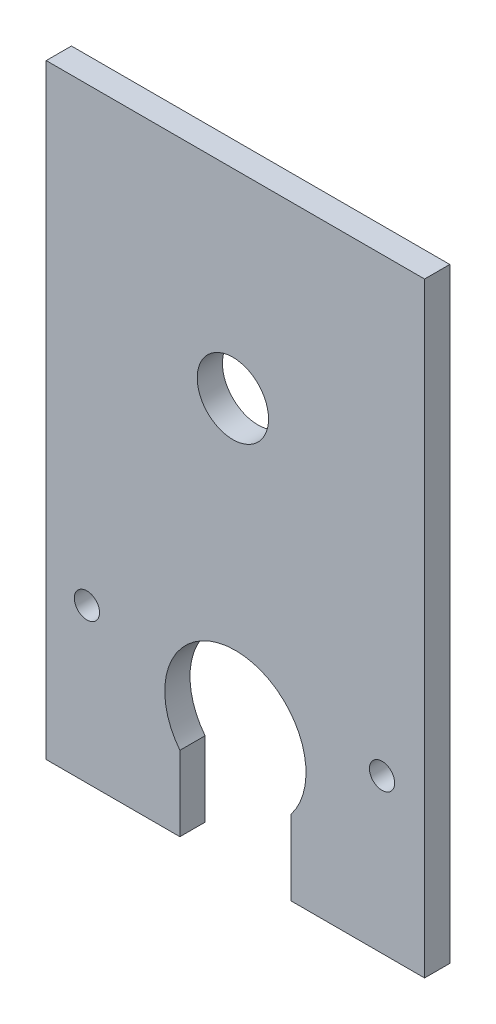
from build123d import *

# Parameters (mm, degrees)
ESQUISSE1_W             = 150
ESQUISSE1_H             = 240
BASE_EXTRUSION_DEPTH    = 10
ENL_V_MAT_EXTRU_1_DEPTH = 10
ESQUISSE3_R             = 14.142135624
ENL_V_MAT_EXTRU_2_DEPTH = 10
ESQUISSE4_R             = 5
ENL_V_MAT_EXTRU_3_DEPTH = 284.19604517


with BuildPart() as part:
    # Esquisse1 → Base-Extrusion (new body)
    with BuildSketch(Plane.XY):
        with Locations((75, 120)):
            Rectangle(ESQUISSE1_W, ESQUISSE1_H)
    extrude(amount=BASE_EXTRUSION_DEPTH)

    # Esquisse2 → Enlèv. mat.-Extru.1 (cut)
    with BuildSketch(Plane.XY.offset(10)):
        with BuildLine():
            Line((53, 0), (97, 0))
            Line((97, 0), (97, 29.679491924))
            ThreePointArc((97, 29.679491924), (75, 75), (53, 29.679491924))
            Line((53, 29.679491924), (53, 0))
        make_face()
    extrude(amount=-ENL_V_MAT_EXTRU_1_DEPTH, mode=Mode.SUBTRACT)

    # Esquisse3 → Enlèv. mat.-Extru.2 (cut)
    with BuildSketch(Plane.XY.offset(10)):
        with Locations((74, 161)):
            Circle(ESQUISSE3_R)
    extrude(amount=-ENL_V_MAT_EXTRU_2_DEPTH, mode=Mode.SUBTRACT)

    # Esquisse4 → Enlèv. mat.-Extru.3 (cut, through all)
    with BuildSketch(Plane(origin=(0, 0, 0), x_dir=(-1, 0, 0), z_dir=(0, 0, -1))):
        with Locations((-16.142927736, 61)):
            Circle(ESQUISSE4_R)
        with Locations((-133.142927736, 61)):
            Circle(ESQUISSE4_R)
    extrude(amount=-ENL_V_MAT_EXTRU_3_DEPTH, mode=Mode.SUBTRACT)


solid = part.part
